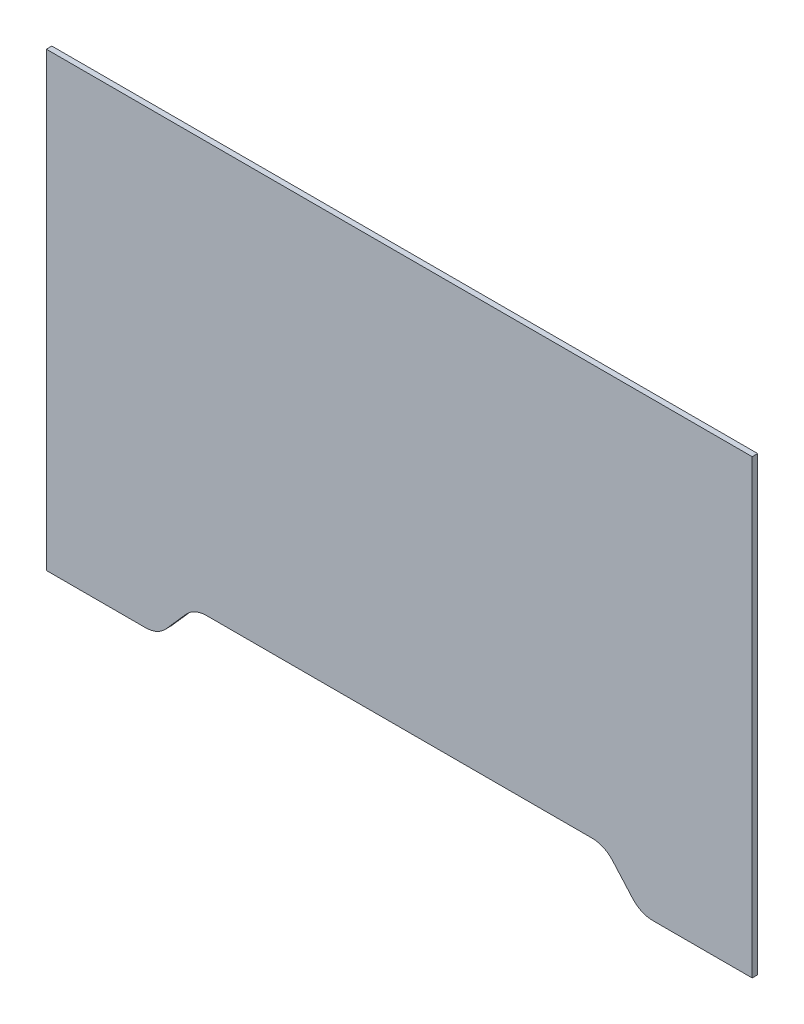
from build123d import *

# Parameters (mm, degrees)
BOSS_EXTRUDE1_DEPTH = 4


with BuildPart() as part:
    # Sketch1 → Boss-Extrude1 (new body)
    with BuildSketch(Plane.XY):
        with BuildLine():
            Line((-170.485837704, -158.228756555), (-155.971675407, -141.771243445))
            ThreePointArc((-155.971675407, -141.771243445), (-149.200431962, -136.771243445), (-140.971675407, -135))
            Line((-140.971675407, -135), (140.971675407, -135))
            ThreePointArc((140.971675407, -135), (149.200431962, -136.771243445), (155.971675407, -141.771243445))
            Line((155.971675407, -141.771243445), (170.485837704, -158.228756555))
            ThreePointArc((170.485837704, -158.228756555), (177.257081148, -163.228756555), (185.485837704, -165))
            Line((185.485837704, -165), (258, -165))
            Line((258, -165), (258, 165))
            Line((258, 165), (-258, 165))
            Line((-258, 165), (-258, -165))
            Line((-258, -165), (-185.485837704, -165))
            ThreePointArc((-185.485837704, -165), (-177.257081148, -163.228756555), (-170.485837704, -158.228756555))
        make_face()
    extrude(amount=BOSS_EXTRUDE1_DEPTH)


solid = part.part
